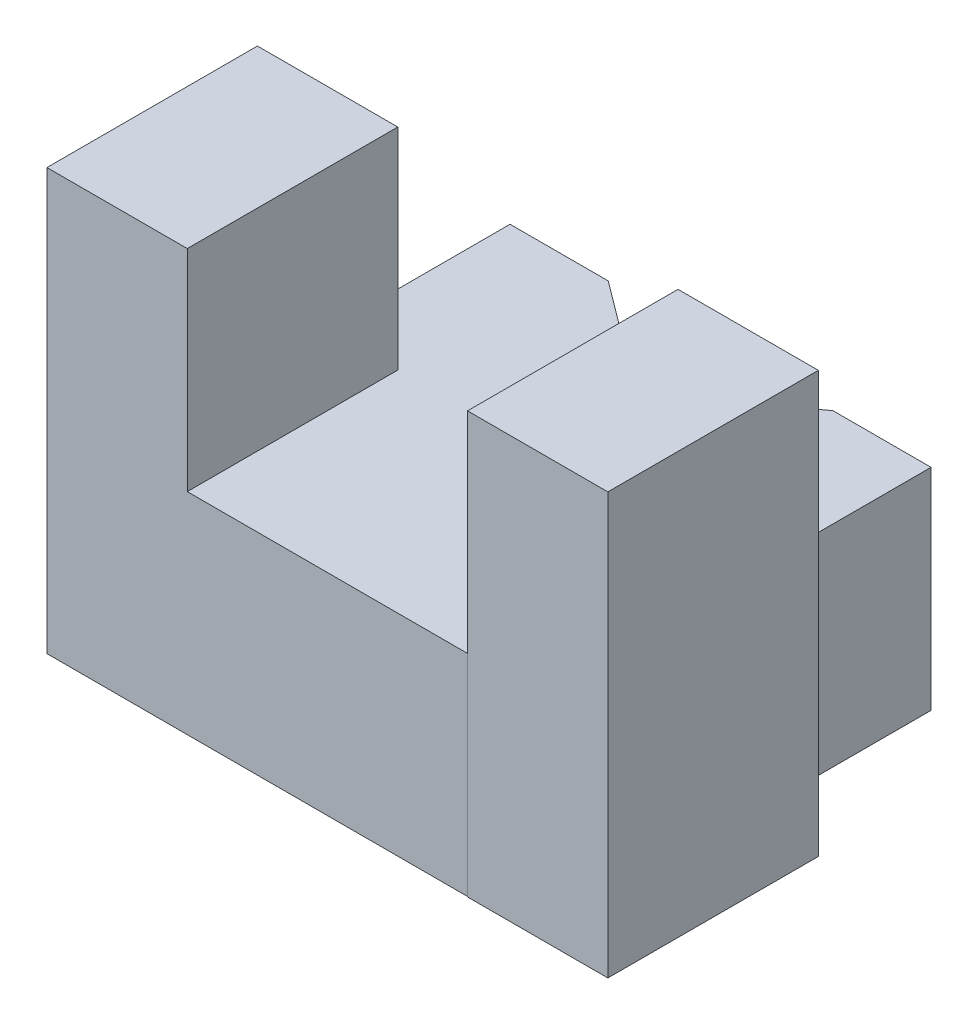
from build123d import *

# Parameters (mm, degrees)
EXTRUDE_1_DEPTH      = 15
EXTRUDE_7_DEPTH      = 15
EXTRUDE_7_DEPTH_BACK = 15
SKETCH_2_W           = 10
SKETCH_2_H           = 15


with BuildPart() as part:
    # 草图1 → 凸台-拉伸1 (new body)
    with BuildSketch(Plane(origin=(0, 0, 0), x_dir=(1, 0, 0), z_dir=(0, 1, 0))):
        Polygon((0, 0), (7, 0), (15, -6), (23, 0), (30, 0), (30, -28), (0, -28), align=None)
    extrude(amount=EXTRUDE_1_DEPTH)

    # 草图2 → 凸台-拉伸7 (add, two sides: drawn at the far end of the back side and taken through both)
    with BuildSketch(Plane(origin=(0, 15, 0), x_dir=(1, 0, 0), z_dir=(0, 1, 0)).offset(-EXTRUDE_7_DEPTH_BACK)):
        with Locations((30, -20.531171216)):
            Rectangle(SKETCH_2_W, SKETCH_2_H)
        with Locations((0, -20.5)):
            Rectangle(SKETCH_2_W, SKETCH_2_H)
    extrude(amount=EXTRUDE_7_DEPTH + EXTRUDE_7_DEPTH_BACK)


solid = part.part
